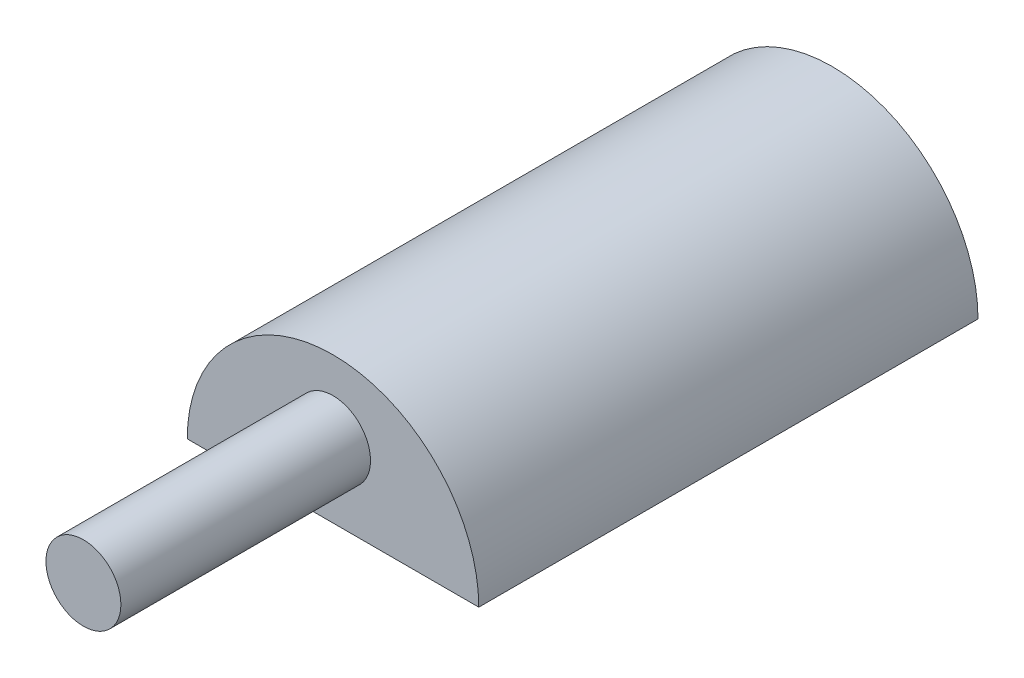
from build123d import *

# Parameters (mm, degrees)
SALIENTE_EXTRUIR1_DEPTH = 254
CROQUIS2_R              = 19.069720967
SALIENTE_EXTRUIR2_DEPTH = 127


with BuildPart() as part:
    # Croquis1 → Saliente-Extruir1 (new body)
    with BuildSketch(Plane.XY):
        with BuildLine():
            Line((0, 0), (-74.168, 0))
            ThreePointArc((-74.168, 0), (0, 74.168), (74.168, 0))
            Line((74.168, 0), (0, 0))
        make_face()
    extrude(amount=SALIENTE_EXTRUIR1_DEPTH)

    # Croquis2 → Saliente-Extruir2 (add)
    with BuildSketch(Plane.XY.offset(254)):
        with Locations((0, 37.084)):
            Circle(CROQUIS2_R)
    extrude(amount=SALIENTE_EXTRUIR2_DEPTH)


solid = part.part
